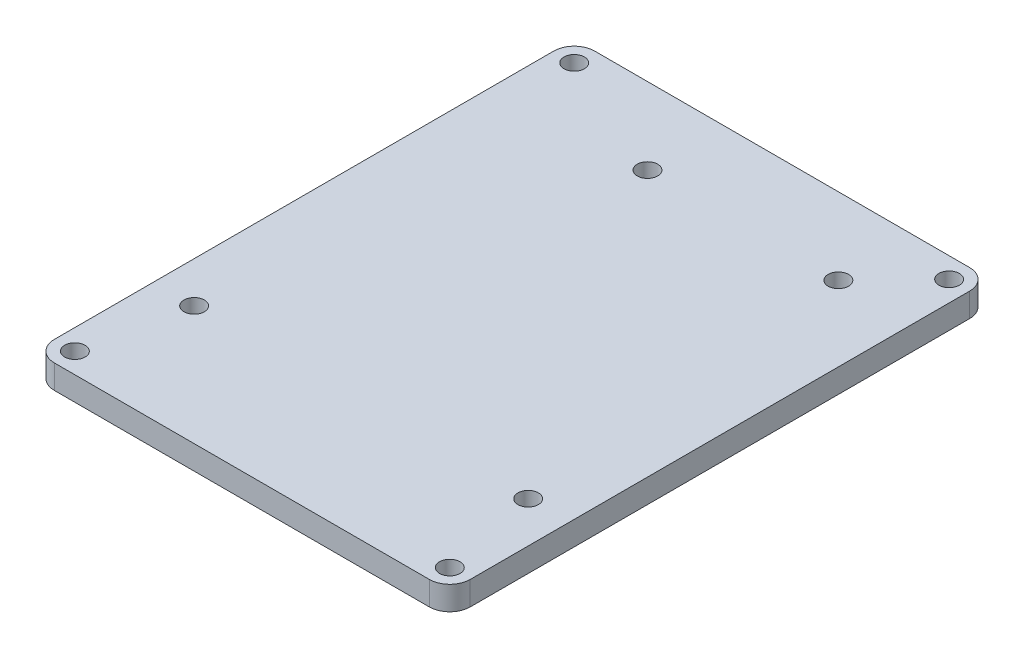
from build123d import *

# Parameters (mm, degrees)
SKETCH1_W           = 61
SKETCH1_H           = 79.25
BOSS_EXTRUDE1_DEPTH = 3.5
SKETCH2_R           = 1.5
CUT_EXTRUDE1_DEPTH  = 3.5
FILLET1_R           = 3
SKETCH3_R           = 1.5
CUT_EXTRUDE2_DEPTH  = 3.5


with BuildPart() as part:
    # Sketch1 → Boss-Extrude1 (new body)
    with BuildSketch(Plane(origin=(0, 0, 0), x_dir=(1, 0, 0), z_dir=(0, 1, 0))):
        Rectangle(SKETCH1_W, SKETCH1_H)
    extrude(amount=BOSS_EXTRUDE1_DEPTH)

    # Sketch2 → Cut-Extrude1 (cut)
    with BuildSketch(Plane(origin=(0, 3.5, 0), x_dir=(1, 0, 0), z_dir=(0, 1, 0))):
        with Locations(Location((-27.5, 36.625, 0), (0, 0, 270))):
            Circle(SKETCH2_R)
        with Locations(Location((27.5, 36.625, 0), (0, 0, 270))):
            Circle(SKETCH2_R)
        with Locations(Location((-27.5, -36.625, 0), (0, 0, 270))):
            Circle(SKETCH2_R)
        with Locations(Location((27.5, -36.625, 0), (0, 0, 270))):
            Circle(SKETCH2_R)
    extrude(amount=-CUT_EXTRUDE1_DEPTH, mode=Mode.SUBTRACT)

    # Fillet1
    fillet1_edges = [part.edges().sort_by_distance(p)[0] for p in [
        (30.5, 1.75, 39.625),
        (-30.5, 1.75, 39.625),
        (-30.5, 1.75, -39.625),
        (30.5, 1.75, -39.625),
    ]]
    fillet(fillet1_edges, radius=FILLET1_R)

    # Sketch3 → Cut-Extrude2 (cut)
    with BuildSketch(Plane(origin=(0, 3.5, 0), x_dir=(1, 0, 0), z_dir=(0, 1, 0))):
        with Locations(Location((-24.5, -22.125, 0), (0, 0, 270))):
            Circle(SKETCH3_R)
        with Locations(Location((24.5, -22.125, 0), (0, 0, 270))):
            Circle(SKETCH3_R)
        with Locations(Location((19.5, 28.375, 0), (0, 0, 270))):
            Circle(SKETCH3_R)
        with Locations(Location((-8.5, 28.375, 0), (0, 0, 270))):
            Circle(SKETCH3_R)
    extrude(amount=-CUT_EXTRUDE2_DEPTH, mode=Mode.SUBTRACT)


solid = part.part
